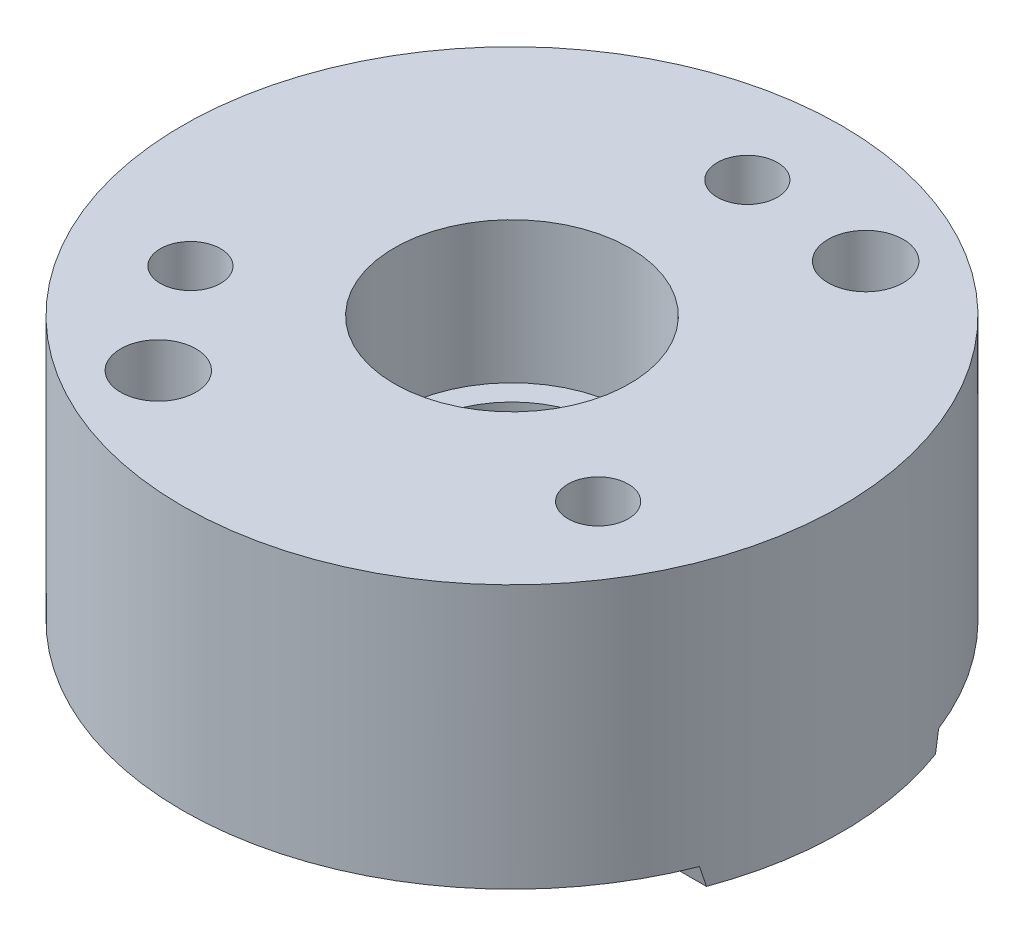
from build123d import *

# Parameters (mm, degrees)
SKETCH1_R                                           = 35
SKETCH1_R_2                                         = 10
BOSS_EXTRUDE1_DEPTH                                 = 30
SKETCH4_R                                           = 12.5
CUT_EXTRUDE2_DEPTH                                  = 15
CBORE_FOR_M6_HEX_SOCKET_HEAD_CAP_SCREW1_D           = 6.4
CBORE_FOR_M6_HEX_SOCKET_HEAD_CAP_SCREW1_CBORE_D     = 11
CBORE_FOR_M6_HEX_SOCKET_HEAD_CAP_SCREW1_CBORE_DEPTH = 8.4
F_8_0MM_DOWEL_HOLE1_D                               = 8
SKETCH14_OUTSIDE_W                                  = 92.688
SKETCH14_OUTSIDE_H                                  = 92.688
SKETCH14_OUTSIDE_W_2                                = 70
SKETCH14_OUTSIDE_H_2                                = 25.4
CUT_EXTRUDE3_DEPTH                                  = 2
SKETCH18_R                                          = 2.1
CUT_EXTRUDE5_DEPTH                                  = 3
CUT_EXTRUDE6_DEPTH                                  = 58.879184825
CUT_EXTRUDE6_DEPTH_BACK                             = 58.879184825
BOSS_EXTRUDE2_DEPTH                                 = 2
DRAFT1_ANGLE                                        = 15
FILLET1_R                                           = 10


with BuildPart() as part:
    # Sketch1 → Boss-Extrude1 (new body)
    with BuildSketch(Plane(origin=(0, 0, 0), x_dir=(1, 0, 0), z_dir=(0, 1, 0))):
        with Locations(Location((0, 0, 0), (0, 0, 270))):
            Circle(SKETCH1_R)
        with Locations(Location((0, 0, 0), (0, 0, 270))):
            Circle(SKETCH1_R_2, mode=Mode.SUBTRACT)
    extrude(amount=-BOSS_EXTRUDE1_DEPTH)

    # Sketch4 → Cut-Extrude2 (cut)
    with BuildSketch(Plane(origin=(0, 0, 0), x_dir=(1, 0, 0), z_dir=(0, 1, 0))):
        with Locations(Location((0, 0, 0), (0, 0, 270))):
            Circle(SKETCH4_R)
    extrude(amount=-CUT_EXTRUDE2_DEPTH, mode=Mode.SUBTRACT)

    # CBORE for M6 Hex Socket Head Cap Screw1 (through all)
    with Locations(Plane(origin=(0, -30, 0), x_dir=(-1, 0, 0), z_dir=(0, -1, 0))):
        with Locations((0, 25), (21.650635095, -12.5), (-21.650635095, -12.5)):
            CounterBoreHole(CBORE_FOR_M6_HEX_SOCKET_HEAD_CAP_SCREW1_D / 2, CBORE_FOR_M6_HEX_SOCKET_HEAD_CAP_SCREW1_CBORE_D / 2, CBORE_FOR_M6_HEX_SOCKET_HEAD_CAP_SCREW1_CBORE_DEPTH)

    # Ø8.0mm Dowel Hole1 (through all)
    with Locations(Plane(origin=(0, -30, 0), x_dir=(-1, 0, 0), z_dir=(0, -1, 0))):
        with Locations((13.75, -23.815698604), (-13.75, 23.815698604)):
            Hole(F_8_0MM_DOWEL_HOLE1_D / 2)

    # Sketch14 outside → Cut-Extrude3 (cut)
    with BuildSketch(Plane.XZ.offset(30)):
        Rectangle(SKETCH14_OUTSIDE_W, SKETCH14_OUTSIDE_H)
        Rectangle(SKETCH14_OUTSIDE_W_2, SKETCH14_OUTSIDE_H_2, mode=Mode.SUBTRACT)
    extrude(amount=-CUT_EXTRUDE3_DEPTH, mode=Mode.SUBTRACT)

    # Sketch18 → Cut-Extrude5 (cut)
    with BuildSketch(Plane.XZ.offset(30)):
        with Locations(Location((-13.665, 0, 0), (0, 0, 270))):
            Circle(SKETCH18_R)
    extrude(amount=-CUT_EXTRUDE5_DEPTH, mode=Mode.SUBTRACT)

    # Sketch19 → Cut-Extrude6 (cut, two sides: drawn at the far end of the back side and taken through both)
    with BuildSketch(Plane(origin=(0, 0, 0), x_dir=(0, 0, -1), z_dir=(1, 0, 0)).offset(-CUT_EXTRUDE6_DEPTH_BACK)):
        Polygon((-12.7, -28), (-12.164101615, -30), (-12.7, -30), align=None)
        Polygon((12.7, -28), (12.164101615, -30), (12.7, -30), align=None)
    extrude(amount=CUT_EXTRUDE6_DEPTH + CUT_EXTRUDE6_DEPTH_BACK, mode=Mode.SUBTRACT)

    # Sketch20 → Boss-Extrude2 (add)
    with BuildSketch(Plane.XZ.offset(30)):
        with BuildLine():
            Line((-12.581122044, 12.164101615), (12.581122044, 12.164101615))
            ThreePointArc((12.581122044, 12.164101615), (0, 17.5), (-12.581122044, 12.164101615))
        make_face()
        with BuildLine():
            Line((-12.581122044, -12.164101615), (12.581122044, -12.164101615))
            ThreePointArc((12.581122044, -12.164101615), (0, -17.5), (-12.581122044, -12.164101615))
        make_face()
    extrude(amount=-BOSS_EXTRUDE2_DEPTH)

    # Draft1
    draft1_faces = [part.faces().sort_by_distance(p)[0] for p in [
        (0, -29, 17.5),
        (0, -29, -17.5),
    ]]
    draft(draft1_faces, Plane(origin=(0, -28, 0), x_dir=(0, 0, -1), z_dir=(0, -1, 0)), DRAFT1_ANGLE)

    # Fillet1
    fillet1_edges = [part.edges().sort_by_distance(p)[0] for p in [
        (11.932625996, -29.000048438, 12.432037829),
        (-11.932625996, -29.000048438, 12.432037829),
        (-11.932625996, -29.000048438, -12.432037829),
        (11.932625996, -29.000048438, -12.432037829),
    ]]
    fillet(fillet1_edges, radius=FILLET1_R)


solid = part.part
